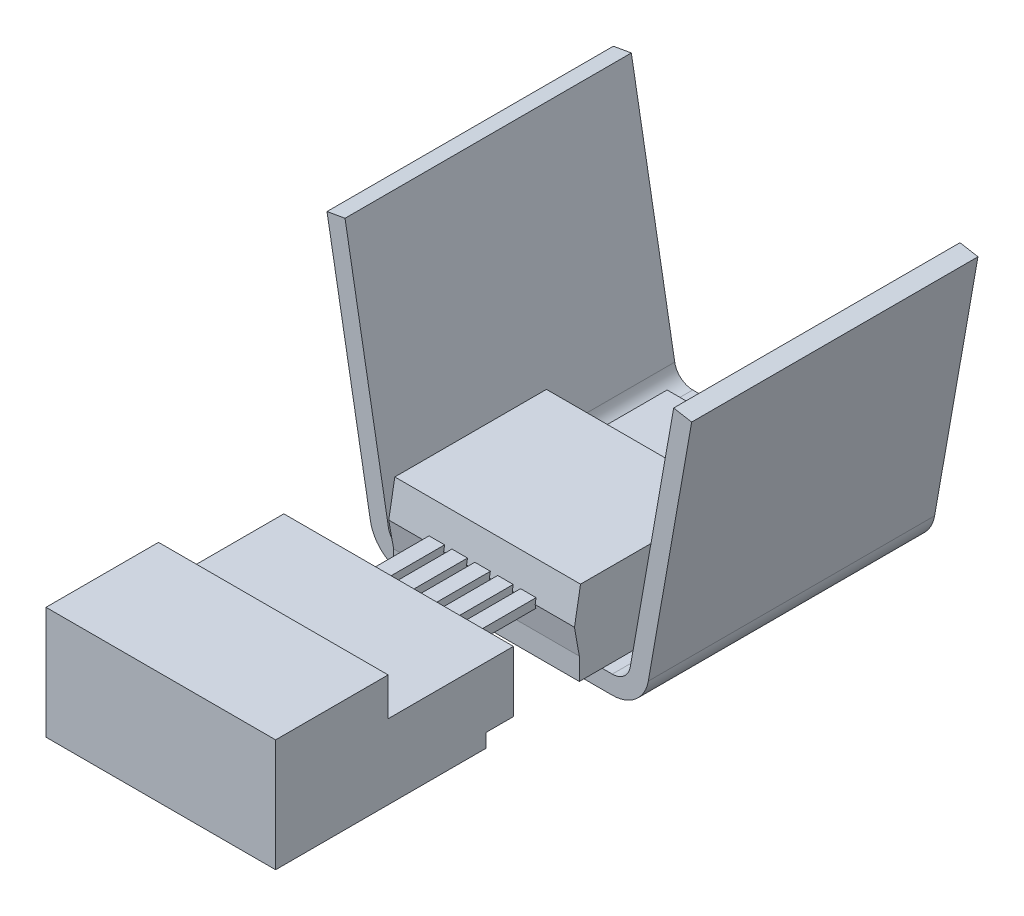
from build123d import *

# Parameters (mm, degrees)
SKETCH1_W                       = 10.3124
SKETCH1_H                       = 15.1892
SKETCH1_R                       = 1.8669
BOSS_EXTRUDE1_DEPTH             = 1.27
BOSS_EXTRUDE2_REACH             = 15.485
BOSS_EXTRUDE2_DIRECTION_2_REACH = 15.485
BOSS_EXTRUDE3_DEPTH             = 0.4318
LPATTERN1_COUNT                 = 5
LPATTERN1_PITCH                 = 1.27
BOSS_EXTRUDE4_DEPTH             = 6.3754
BOSS_EXTRUDE5_DEPTH             = 11.1252
BOSS_EXTRUDE5_DEPTH_BACK        = 4.7752


with BuildPart() as part:
    # Sketch1 → Boss-Extrude1 (new body)
    with BuildSketch(Plane(origin=(0, 0, 0), x_dir=(1, 0, 0), z_dir=(0, 1, 0))):
        with Locations((0, -4.8006)):
            Rectangle(SKETCH1_W, SKETCH1_H)
        with Locations(Location((0, 0, 0), (0, 0, 270))):
            Circle(SKETCH1_R, mode=Mode.SUBTRACT)
    extrude(amount=BOSS_EXTRUDE1_DEPTH)

    # Boss-Extrude2: up to this face of the body (flat: up to its plane)
    boss_extrude2_end = Plane(part.part.faces().sort_by_distance((5.1562, 0.635, 4.8006))[0])
    # Sketch2 → Boss-Extrude2 (add, up to the picked face)
    with BuildSketch(Plane(origin=(0, 0, 0), x_dir=(0, 0, -1), z_dir=(1, 0, 0)), mode=Mode.PRIVATE) as boss_extrude2_sk1:
        Polygon((-3.302, 1.2192), (-3.906625217, 4.6482), (-12.32801942, 4.6482), (-12.663922319, 2.7432), (-12.3952, 1.2192), align=None)
    boss_extrude2_tool1 = split(extrude(boss_extrude2_sk1.sketch, amount=BOSS_EXTRUDE2_REACH, mode=Mode.PRIVATE), bisect_by=boss_extrude2_end, keep=Keep.BOTH, mode=Mode.PRIVATE)
    add(boss_extrude2_tool1.solids().sort_by(Axis((0, 2.911082, 8.056355), (1, 0, 0)))[0])

    # Boss-Extrude2 direction 2: up to this face of the body (flat: up to its plane)
    boss_extrude2_direction_2_end = Plane(part.part.faces().sort_by_distance((-5.1562, 0.635, 4.8006))[0])
    # Sketch2 → Boss-Extrude2 direction 2 (add, up to the picked face)
    with BuildSketch(Plane(origin=(0, 0, 0), x_dir=(0, 0, -1), z_dir=(1, 0, 0)), mode=Mode.PRIVATE) as boss_extrude2_direction_2_sk1:
        Polygon((-3.302, 1.2192), (-3.906625217, 4.6482), (-12.32801942, 4.6482), (-12.663922319, 2.7432), (-12.3952, 1.2192), align=None)
    boss_extrude2_direction_2_tool1 = split(extrude(boss_extrude2_direction_2_sk1.sketch, amount=-BOSS_EXTRUDE2_DIRECTION_2_REACH, mode=Mode.PRIVATE), bisect_by=boss_extrude2_direction_2_end, keep=Keep.BOTH, mode=Mode.PRIVATE)
    add(boss_extrude2_direction_2_tool1.solids().sort_by(Axis((0, 2.911082, 8.056355), (-1, 0, 0)))[0])

    # Sketch3 → Boss-Extrude3 (add, symmetric)
    with BuildSketch(Plane(origin=(2.54, 0, 0), x_dir=(0, 0, -1), z_dir=(1, 0, 0))):
        with BuildLine():
            Line((-11.1252, 2.54), (-18.7452, 2.54))
            ThreePointArc((-18.7452, 2.54), (-18.762931645, 2.540154742), (-18.780657889, 2.54061892))
            Line((-18.780657889, 2.54061892), (-25.050636059, 2.759571382))
            Line((-25.050636059, 2.759571382), (-25.032907115, 3.267261922))
            Line((-25.032907115, 3.267261922), (-18.762928944, 3.04830946))
            ThreePointArc((-18.762928944, 3.04830946), (-18.754065822, 3.048077371), (-18.7452, 3.048))
            Line((-18.7452, 3.048), (-11.1252, 3.048))
            Line((-11.1252, 3.048), (-11.1252, 2.54))
        make_face()
    boss_extrude3 = extrude(amount=BOSS_EXTRUDE3_DEPTH, both=True)

    # LPattern1: Boss-Extrude3 ×5
    with Locations(*[(-i * LPATTERN1_PITCH, 0, 0) for i in range(1, LPATTERN1_COUNT)]):
        add(boss_extrude3)

    # Sketch4 → Boss-Extrude4 (add, symmetric)
    with BuildSketch(Plane(origin=(0, 0, 0), x_dir=(0, 0, -1), z_dir=(1, 0, 0))):
        Polygon((-18.796, 0.5969), (-30.48, 0.5969), (-30.48, 6.8453), (-24.2316, 6.8453), (-24.2316, 4.7371), (-17.272, 4.7371), (-17.272, 1.3589), (-18.796, 1.3589), align=None)
    extrude(amount=BOSS_EXTRUDE4_DEPTH, both=True)

    # Sketch5 → Boss-Extrude5 (add, two sides: drawn at the far end of the back side and taken through both)
    with BuildSketch(Plane.XY.offset(-BOSS_EXTRUDE5_DEPTH_BACK)):
        with BuildLine():
            Line((5.715, 0), (-5.715, 0))
            ThreePointArc((-5.715, 0), (-6.368072211, 0.237698846), (-6.715564677, 0.839573451))
            Line((-6.715564677, 0.839573451), (-9.124737032, 14.502668828))
            Line((-9.124737032, 14.502668828), (-10.125301709, 14.326242279))
            Line((-10.125301709, 14.326242279), (-7.716129354, 0.663146903))
            ThreePointArc((-7.716129354, 0.663146903), (-7.021144423, -0.540602308), (-5.715, -1.016))
            Line((-5.715, -1.016), (5.715, -1.016))
            ThreePointArc((5.715, -1.016), (7.021144423, -0.540602308), (7.716129354, 0.663146903))
            Line((7.716129354, 0.663146903), (10.125301709, 14.326242279))
            Line((10.125301709, 14.326242279), (9.124737032, 14.502668828))
            Line((9.124737032, 14.502668828), (6.715564677, 0.839573451))
            ThreePointArc((6.715564677, 0.839573451), (6.368072211, 0.237698846), (5.715, 0))
        make_face()
    extrude(amount=BOSS_EXTRUDE5_DEPTH + BOSS_EXTRUDE5_DEPTH_BACK)


solid = part.part
